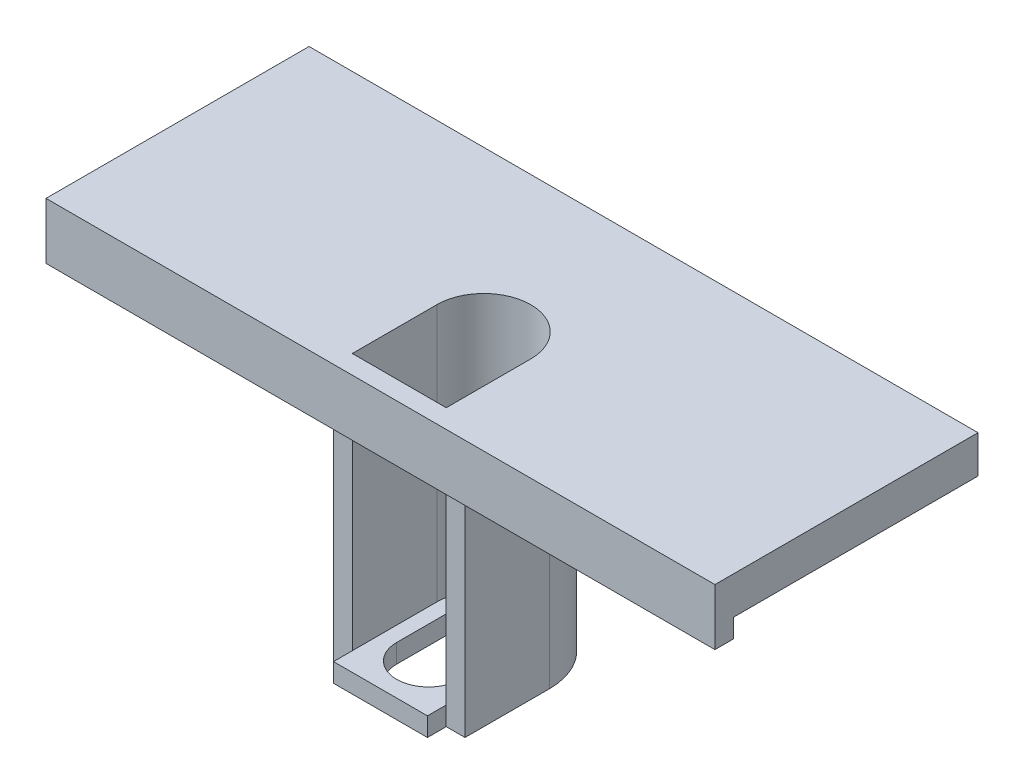
from build123d import *

# Parameters (mm, degrees)
BOSS_EXTRUDE1_DEPTH = 2.54
BOSS_EXTRUDE2_START = -16.129
BOSS_EXTRUDE2_DEPTH = 18.669
SKETCH3_W           = 45.212
SKETCH3_H           = 3.81
BOSS_EXTRUDE3_DEPTH = 1.27
BOSS_EXTRUDE4_START = -16.129
BOSS_EXTRUDE4_DEPTH = 1.27


with BuildPart() as part:
    # Sketch1 → Boss-Extrude1 (new body)
    with BuildSketch(Plane(origin=(0, 0, 0), x_dir=(1, 0, 0), z_dir=(0, 1, 0))):
        with BuildLine():
            Line((22.606, 0), (22.606, 16.51))
            Line((22.606, 16.51), (-22.606, 16.51))
            Line((-22.606, 16.51), (-22.606, 0))
            Line((-22.606, 0), (-4.445, 0))
            Line((-4.445, 0), (-4.445, 5.715))
            ThreePointArc((-4.445, 5.715), (0, 10.16), (4.445, 5.715))
            Line((4.445, 5.715), (4.445, 0))
            Line((4.445, 0), (22.606, 0))
        make_face()
    extrude(amount=BOSS_EXTRUDE1_DEPTH)

    # Sketch2 → Boss-Extrude2 (add)
    with BuildSketch(Plane(origin=(0, 0, 0), x_dir=(1, 0, 0), z_dir=(0, 1, 0)).offset(BOSS_EXTRUDE2_START)):
        with BuildLine():
            Line((-4.445, 0), (-3.175, 0))
            Line((-3.175, 0), (-3.175, 5.715))
            ThreePointArc((-3.175, 5.715), (0, 8.89), (3.175, 5.715))
            Line((3.175, 5.715), (3.175, 0))
            Line((3.175, 0), (4.445, 0))
            Line((4.445, 0), (4.445, 5.715))
            ThreePointArc((4.445, 5.715), (0, 10.16), (-4.445, 5.715))
            Line((-4.445, 5.715), (-4.445, 0))
        make_face()
    extrude(amount=BOSS_EXTRUDE2_DEPTH)

    # Sketch3 → Boss-Extrude3 (add)
    with BuildSketch(Plane.XY):
        with Locations((0, 0.635)):
            Rectangle(SKETCH3_W, SKETCH3_H)
    extrude(amount=BOSS_EXTRUDE3_DEPTH)

    # Sketch4 → Boss-Extrude4 (add)
    with BuildSketch(Plane(origin=(0, 0, 0), x_dir=(1, 0, 0), z_dir=(0, 1, 0)).offset(BOSS_EXTRUDE4_START)):
        with BuildLine():
            Line((3.175, 5.715), (3.175, -1.27))
            Line((3.175, -1.27), (-3.175, -1.27))
            Line((-3.175, -1.27), (-3.175, 5.715))
            ThreePointArc((-3.175, 5.715), (0, 8.89), (3.175, 5.715))
        make_face()
        with BuildLine():
            Line((-2.159, 5.715), (-2.159, 1.982909029))
            ThreePointArc((-2.159, 1.982909029), (0, -0.176090971), (2.159, 1.982909029))
            Line((2.159, 1.982909029), (2.159, 5.715))
            ThreePointArc((2.159, 5.715), (0, 7.874), (-2.159, 5.715))
        make_face(mode=Mode.SUBTRACT)
    extrude(amount=BOSS_EXTRUDE4_DEPTH)


solid = part.part
